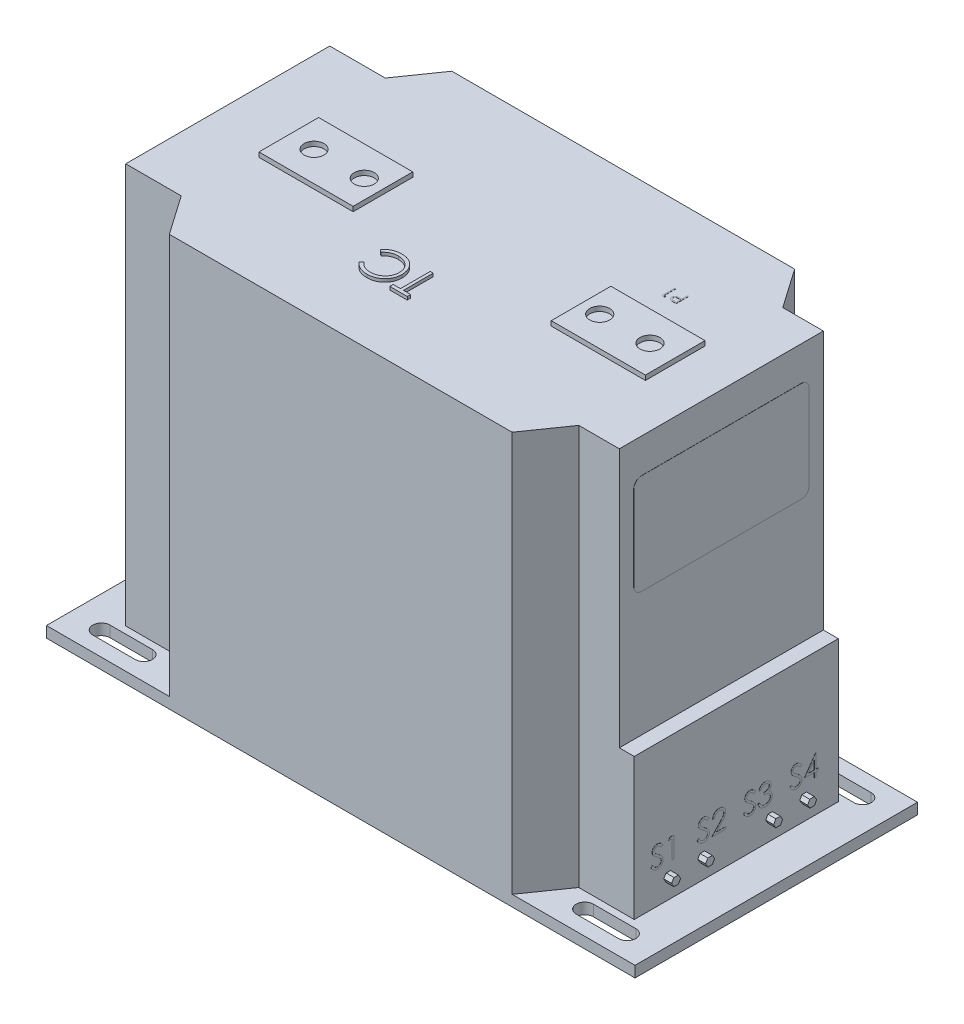
from build123d import *

# Parameters (mm, degrees)
CROQUIS1_W              = 375
CROQUIS1_H              = 180
SALIENTE_EXTRUIR1_DEPTH = 262
CROQUIS2_W              = 60
CROQUIS2_H              = 38
CROQUIS2_R              = 6.35
SALIENTE_EXTRUIR2_DEPTH = 3
CORTAR_EXTRUIR1_DEPTH   = 255
CORTAR_EXTRUIR2_DEPTH   = 277
CROQUIS5_W              = 130
CROQUIS5_H              = 165
CORTAR_EXTRUIR3_DEPTH   = 9.5
SALIENTE_EXTRUIR3_DEPTH = 5
SALIENTE_EXTRUIR4_DEPTH = 0.1
SALIENTE_EXTRUIR5_DEPTH = 0.1
CROQUIS9_R              = 4.75
SALIENTE_EXTRUIR6_DEPTH = 5
SALIENTE_EXTRUIR7_DEPTH = 0.1
SALIENTE_EXTRUIR8_DEPTH = 2


with BuildPart() as part:
    # Croquis1 → Saliente-Extruir1 (new body)
    with BuildSketch(Plane(origin=(0, 0, 0), x_dir=(1, 0, 0), z_dir=(0, 1, 0))):
        Rectangle(CROQUIS1_W, CROQUIS1_H)
    extrude(amount=SALIENTE_EXTRUIR1_DEPTH)

    # Croquis2 → Saliente-Extruir2 (add)
    # profile 1 of 2: a face of its own
    with BuildSketch(Plane(origin=(0, 262, 0), x_dir=(1, 0, 0), z_dir=(0, 1, 0))):
        with Locations((93.107795334, 0)):
            Rectangle(CROQUIS2_W, CROQUIS2_H)
        with Locations(Location((75, 0, 0), (0, 0, 270))):
            Circle(CROQUIS2_R, mode=Mode.SUBTRACT)
        with Locations(Location((107, 0, 0), (0, 0, 270))):
            Circle(CROQUIS2_R, mode=Mode.SUBTRACT)
    # profile 2 of 2: a face of its own
    with BuildSketch(Plane(origin=(0, 262, 0), x_dir=(1, 0, 0), z_dir=(0, 1, 0))):
        with Locations((-93.107795334, 0)):
            Rectangle(CROQUIS2_W, CROQUIS2_H)
        with Locations(Location((-107, 0, 0), (0, 0, 90))):
            Circle(CROQUIS2_R, mode=Mode.SUBTRACT)
        with Locations(Location((-75, 0, 0), (0, 0, 90))):
            Circle(CROQUIS2_R, mode=Mode.SUBTRACT)
    extrude(amount=SALIENTE_EXTRUIR2_DEPTH)

    # Croquis3 → Cortar-Extruir1 (cut)
    # profile 1 of 2: a face of its own
    with BuildSketch(Plane(origin=(0, 262, 0), x_dir=(1, 0, 0), z_dir=(0, 1, 0))):
        Polygon((-162, 65), (-126.646674595, 65), (-109.194539491, 90), (-187.5, 90), (-187.5, -90), (-109.194539491, -90), (-126.646674595, -65), (-162, -65), align=None)
        with BuildLine():
            ThreePointArc((-167.5, -80.5), (-173, -75), (-167.5, -69.5))
            Line((-167.5, -69.5), (-140.5, -69.5))
            ThreePointArc((-140.5, -69.5), (-135, -75), (-140.5, -80.5))
            Line((-140.5, -80.5), (-167.5, -80.5))
        make_face(mode=Mode.SUBTRACT)
        with BuildLine():
            Line((-140.5, 69.5), (-167.5, 69.5))
            ThreePointArc((-167.5, 69.5), (-173, 75), (-167.5, 80.5))
            Line((-167.5, 80.5), (-140.5, 80.5))
            ThreePointArc((-140.5, 80.5), (-135, 75), (-140.5, 69.5))
        make_face(mode=Mode.SUBTRACT)
    # profile 2 of 2: a face of its own
    with BuildSketch(Plane(origin=(0, 262, 0), x_dir=(1, 0, 0), z_dir=(0, 1, 0))):
        Polygon((187.5, 90), (109.194539491, 90), (126.646674595, 65), (162, 65), (162, -65), (126.646674595, -65), (109.194539491, -90), (187.5, -90), align=None)
        with BuildLine():
            Line((140.5, -69.5), (167.5, -69.5))
            ThreePointArc((167.5, -69.5), (173, -75), (167.5, -80.5))
            Line((167.5, -80.5), (140.5, -80.5))
            ThreePointArc((140.5, -80.5), (135, -75), (140.5, -69.5))
        make_face(mode=Mode.SUBTRACT)
        with BuildLine():
            ThreePointArc((167.5, 80.5), (173, 75), (167.5, 69.5))
            Line((167.5, 69.5), (140.5, 69.5))
            ThreePointArc((140.5, 69.5), (135, 75), (140.5, 80.5))
            Line((140.5, 80.5), (167.5, 80.5))
        make_face(mode=Mode.SUBTRACT)
    extrude(amount=-CORTAR_EXTRUIR1_DEPTH, mode=Mode.SUBTRACT)

    # Croquis4 → Cortar-Extruir2 (cut)
    with BuildSketch(Plane(origin=(0, 262, 0), x_dir=(1, 0, 0), z_dir=(0, 1, 0))):
        with BuildLine():
            Line((-167.5, 80.5), (-140.5, 80.5))
            ThreePointArc((-140.5, 80.5), (-135, 75), (-140.5, 69.5))
            Line((-140.5, 69.5), (-167.5, 69.5))
            ThreePointArc((-167.5, 69.5), (-173, 75), (-167.5, 80.5))
        make_face()
        with BuildLine():
            Line((-167.5, -69.5), (-140.5, -69.5))
            ThreePointArc((-140.5, -69.5), (-135, -75), (-140.5, -80.5))
            Line((-140.5, -80.5), (-167.5, -80.5))
            ThreePointArc((-167.5, -80.5), (-173, -75), (-167.5, -69.5))
        make_face()
        with BuildLine():
            Line((140.5, 80.5), (167.5, 80.5))
            ThreePointArc((167.5, 80.5), (173, 75), (167.5, 69.5))
            Line((167.5, 69.5), (140.5, 69.5))
            ThreePointArc((140.5, 69.5), (135, 75), (140.5, 80.5))
        make_face()
        with BuildLine():
            Line((140.5, -69.5), (167.5, -69.5))
            ThreePointArc((167.5, -69.5), (173, -75), (167.5, -80.5))
            Line((167.5, -80.5), (140.5, -80.5))
            ThreePointArc((140.5, -80.5), (135, -75), (140.5, -69.5))
        make_face()
    extrude(amount=-CORTAR_EXTRUIR2_DEPTH, mode=Mode.SUBTRACT)

    # Croquis5 → Cortar-Extruir3 (cut)
    with BuildSketch(Plane(origin=(162, 0, 0), x_dir=(0, 0, -1), z_dir=(1, 0, 0))):
        with Locations((0, 179.5)):
            Rectangle(CROQUIS5_W, CROQUIS5_H)
    extrude(amount=-CORTAR_EXTRUIR3_DEPTH, mode=Mode.SUBTRACT)

    # Croquis6 → Saliente-Extruir3 (add)
    with BuildSketch(Plane(origin=(162, 0, 0), x_dir=(0, 0, -1), z_dir=(1, 0, 0))):
        Polygon((24.553418013, 20), (23.11004234, 22.5), (20.223290994, 22.5), (18.779915321, 20), (20.223290994, 17.5), (23.11004234, 17.5), align=None)
        Polygon((44.857060225, 17.546077271), (46.222022868, 20.089738081), (44.701629309, 22.54366081), (41.816273108, 22.453922729), (40.451310465, 19.910261919), (41.971704024, 17.45633919), align=None)
        Polygon((-41.971704024, 17.45633919), (-44.857060225, 17.546077271), (-46.222022868, 20.089738081), (-44.701629309, 22.54366081), (-41.816273108, 22.453922729), (-40.451310465, 19.910261919), align=None)
        Polygon((-23.11004234, 17.5), (-24.553418013, 20), (-23.11004234, 22.5), (-20.223290994, 22.5), (-18.779915321, 20), (-20.223290994, 17.5), align=None)
    extrude(amount=SALIENTE_EXTRUIR3_DEPTH)

    # Croquis7 → Saliente-Extruir4 (add)
    # profile 1 of 8: a face of its own
    with BuildSketch(Plane(origin=(162, 0, 0), x_dir=(0, 0, -1), z_dir=(1, 0, 0))):
        with BuildLine():
            Line((-54.484508547, 30.4061874), (-53.366177551, 31.076655983))
            add(Edge.make_bspline(
                [(-53.366177551, 31.076655983), (-53.262165166, 30.902543576), (-53.06288145, 30.568950922), (-52.730446254, 30.118183924), (-52.385985548, 29.735059105), (-52.026948483, 29.421805261), (-51.655526596, 29.175180005), (-51.269295203, 29.00054657), (-50.869555859, 28.891629044), (-50.59751195, 28.87839955), (-50.461697049, 28.871794872)],
                knots=[0, 0, 0, 0, 1.272034388, 2.437168799, 3.508375237, 4.49857839, 5.41946034, 6.295179144, 7.148887113, 8, 8, 8, 8], degree=3))
            add(Edge.make_bspline(
                [(-50.461697049, 28.871794872), (-50.345708022, 28.87502533), (-50.115759505, 28.881429722), (-49.777235551, 28.942967278), (-49.448465048, 29.03750717), (-49.136224067, 29.172901762), (-48.844821, 29.336710919), (-48.589283788, 29.534567007), (-48.368371396, 29.756084511), (-48.187664326, 30.003215378), (-48.049022526, 30.268997457), (-47.94246322, 30.541805369), (-47.883328566, 30.825924659), (-47.8744206, 31.017220159), (-47.869925214, 31.113757011)],
                knots=[0, 0, 0, 0, 1.095163259, 2.171163733, 3.241058638, 4.321873601, 5.38011039, 6.391990106, 7.366004449, 8.327778327, 9.272591725, 10.192022065, 11.087607919, 12, 12, 12, 12], degree=3))
            add(Edge.make_bspline(
                [(-47.869925214, 31.113757011), (-47.875497757, 31.223902485), (-47.886825924, 31.447812137), (-47.982572887, 31.778162016), (-48.133193552, 32.105083337), (-48.272147592, 32.307305383), (-48.344288361, 32.412293002)],
                knots=[0, 0, 0, 0, 0.938893495, 1.908633276, 2.914225137, 4, 4, 4, 4], degree=3))
            add(Edge.make_bspline(
                [(-48.344288361, 32.412293002), (-48.403519552, 32.488065222), (-48.527868027, 32.64713952), (-48.741641959, 32.883923595), (-48.992490069, 33.128165833), (-49.271827911, 33.389192626), (-49.589830955, 33.654863762), (-49.93653912, 33.937848027), (-50.320804301, 34.22738375), (-50.590299422, 34.421559816), (-50.729354467, 34.521751469)],
                knots=[0, 0, 0, 0, 0.722233717, 1.516239348, 2.393582979, 3.351407094, 4.387010283, 5.505090956, 6.712668013, 8, 8, 8, 8], degree=3))
            add(Edge.make_bspline(
                [(-50.729354467, 34.521751469), (-50.868540405, 34.620889285), (-51.13465332, 34.810433241), (-51.506803318, 35.091739314), (-51.839590426, 35.34892894), (-52.131535518, 35.584423272), (-52.382510184, 35.798254248), (-52.594492125, 35.988368482), (-52.762081314, 36.159907537), (-52.855273538, 36.271188799), (-52.89711455, 36.321151342)],
                knots=[0, 0, 0, 0, 1.452282411, 2.77665338, 3.964542531, 5.026858415, 5.96415736, 6.766646006, 7.446254459, 8, 8, 8, 8], degree=3))
            add(Edge.make_bspline(
                [(-52.89711455, 36.321151342), (-52.955597087, 36.399018356), (-53.070610845, 36.55215429), (-53.222428782, 36.791507175), (-53.351466689, 37.036523684), (-53.452621933, 37.28786222), (-53.537803474, 37.541994243), (-53.595096843, 37.802235559), (-53.630972064, 38.067418432), (-53.634645941, 38.245874223), (-53.636485043, 38.335207165)],
                knots=[0, 0, 0, 0, 1.068054152, 2.10047183, 3.106115577, 4.101338837, 5.06977816, 6.043150881, 7.020423561, 8, 8, 8, 8], degree=3))
            add(Edge.make_bspline(
                [(-53.636485043, 38.335207165), (-53.631551664, 38.475170896), (-53.621790353, 38.752106732), (-53.539238397, 39.156657788), (-53.408939067, 39.542898115), (-53.22639589, 39.90700384), (-52.991077919, 40.239494304), (-52.71876129, 40.544194091), (-52.394414303, 40.800343196), (-52.038539804, 41.024150679), (-51.649011255, 41.199327242), (-51.240831352, 41.331471422), (-50.813351348, 41.4063457), (-50.523809738, 41.417090675), (-50.376894698, 41.422542735)],
                knots=[0, 0, 0, 0, 1.005424448, 1.989358655, 2.955360095, 3.929531133, 4.905563448, 5.876582895, 6.856512386, 7.866279853, 8.892233794, 9.918561126, 10.94386622, 12, 12, 12, 12], degree=3))
            add(Edge.make_bspline(
                [(-50.376894698, 41.422542735), (-50.221001819, 41.417165829), (-49.910980638, 41.406472878), (-49.45495533, 41.313500066), (-49.015895479, 41.159661218), (-48.662702186, 40.985079088), (-48.38627776, 40.81071332), (-48.17547011, 40.651888389), (-47.961847603, 40.469041996), (-47.743687098, 40.261687108), (-47.524685201, 40.027921114), (-47.301590604, 39.769344998), (-47.073881612, 39.487538969), (-46.927393688, 39.286363028), (-46.852297009, 39.183230669)],
                knots=[0, 0, 0, 0, 1.286793592, 2.559021753, 3.825965368, 5.121522368, 5.803751409, 6.523245864, 7.299691795, 8.125521123, 9.008227632, 9.944561021, 10.946284179, 12, 12, 12, 12], degree=3))
            Line((-46.852297009, 39.183230669), (-47.925576756, 38.36965812))
            add(Edge.make_bspline(
                [(-47.925576756, 38.36965812), (-47.990384299, 38.45314811), (-48.115188473, 38.613930311), (-48.304665997, 38.839095701), (-48.483254637, 39.044777037), (-48.659204065, 39.223427967), (-48.82322166, 39.384831864), (-48.982414051, 39.52301904), (-49.13449032, 39.639343464), (-49.326188166, 39.7634843), (-49.567025971, 39.886540132), (-49.869348474, 39.990669088), (-50.185284692, 40.05324328), (-50.400465144, 40.061516754), (-50.509398371, 40.065705128)],
                knots=[0, 0, 0, 0, 1.181633172, 2.275549214, 3.290209073, 4.226197932, 5.078386478, 5.862611352, 6.581680152, 7.217281963, 8.414376989, 9.595101626, 10.782541182, 12, 12, 12, 12], degree=3))
            add(Edge.make_bspline(
                [(-50.509398371, 40.065705128), (-50.646061417, 40.061125191), (-50.909603227, 40.052293213), (-51.28376275, 39.955833745), (-51.620516574, 39.80395588), (-51.909867043, 39.591098671), (-52.150777641, 39.338909205), (-52.325045298, 39.048703413), (-52.429934313, 38.728246118), (-52.442733643, 38.504704738), (-52.449252137, 38.390858707)],
                knots=[0, 0, 0, 0, 1.14458467, 2.207223713, 3.21896685, 4.227309161, 5.202851033, 6.127160689, 7.046193047, 8, 8, 8, 8], degree=3))
            add(Edge.make_bspline(
                [(-52.449252137, 38.390858707), (-52.447766212, 38.319982583), (-52.444791932, 38.178114438), (-52.40330981, 37.968521266), (-52.350017703, 37.759457572), (-52.265567875, 37.551863286), (-52.148979971, 37.342107822), (-51.99588005, 37.12657923), (-51.803061877, 36.903377831), (-51.655360074, 36.758207103), (-51.577377971, 36.681561331)],
                knots=[0, 0, 0, 0, 0.858281714, 1.717966888, 2.583508476, 3.4729293, 4.427298488, 5.488583878, 6.674047936, 8, 8, 8, 8], degree=3))
            add(Edge.make_bspline(
                [(-51.577377971, 36.681561331), (-51.548419808, 36.655719002), (-51.47962184, 36.594323542), (-51.353846763, 36.493811052), (-51.187753449, 36.369824383), (-50.985679057, 36.216413991), (-50.74389766, 36.038457274), (-50.462382671, 35.838229632), (-50.144272116, 35.609231023), (-49.918537493, 35.449129604), (-49.799178686, 35.364474826)],
                knots=[0, 0, 0, 0, 0.420754252, 0.999615792, 1.744751191, 2.668019286, 3.750313428, 4.999500688, 6.413464383, 8, 8, 8, 8], degree=3))
            add(Edge.make_bspline(
                [(-49.799178686, 35.364474826), (-49.655600978, 35.259997069), (-49.377582646, 35.057690371), (-48.982001912, 34.753738247), (-48.623325911, 34.456468407), (-48.30029535, 34.167779238), (-48.00971894, 33.889860553), (-47.754820413, 33.61936877), (-47.533002514, 33.358241754), (-47.294200111, 33.023458507), (-47.050186924, 32.612291909), (-46.840631226, 32.1085319), (-46.708496996, 31.602813665), (-46.691217756, 31.262911634), (-46.682692308, 31.095206497)],
                knots=[0, 0, 0, 0, 1.163667725, 2.253281268, 3.268753668, 4.215851969, 5.092017293, 5.902905408, 6.650798638, 7.335211899, 8.59617414, 9.77448103, 10.901945474, 12, 12, 12, 12], degree=3))
            add(Edge.make_bspline(
                [(-46.682692308, 31.095206497), (-46.685176133, 30.976603748), (-46.69009555, 30.741701435), (-46.746644242, 30.396778972), (-46.829495358, 30.061775387), (-46.954368236, 29.740831599), (-47.106780174, 29.428076097), (-47.300176408, 29.131712902), (-47.524345335, 28.845182765), (-47.781496768, 28.576126116), (-48.062884554, 28.329133054), (-48.360290185, 28.109419042), (-48.674200443, 27.926220319), (-49.002912414, 27.776727553), (-49.346501603, 27.659806222), (-49.704852453, 27.575090913), (-50.078555665, 27.523097601), (-50.332557485, 27.517701003), (-50.461697049, 27.514957265)],
                knots=[0, 0, 0, 0, 0.983748083, 1.948392443, 2.894712957, 3.844097841, 4.80183111, 5.778335162, 6.776009319, 7.81870978, 8.863265674, 9.881300176, 10.883814829, 11.87499822, 12.874611388, 13.892143829, 14.928324115, 16, 16, 16, 16], degree=3))
            add(Edge.make_bspline(
                [(-50.461697049, 27.514957265), (-50.561616351, 27.51688941), (-50.760196575, 27.520729366), (-51.053919914, 27.554676467), (-51.341709433, 27.602706293), (-51.619953892, 27.678959475), (-51.892238156, 27.77147662), (-52.157378001, 27.885392341), (-52.415501925, 28.021906764), (-52.668056479, 28.177992124), (-52.914399341, 28.359638957), (-53.152219949, 28.571205446), (-53.389321335, 28.806856611), (-53.618705244, 29.072991776), (-53.845011474, 29.365311315), (-54.063778081, 29.686550193), (-54.279533383, 30.034958643), (-54.414907324, 30.280133223), (-54.484508547, 30.4061874)],
                knots=[0, 0, 0, 0, 0.915332311, 1.819136955, 2.706846663, 3.586547465, 4.459518054, 5.340707479, 6.227863349, 7.133153174, 8.059268498, 9.028702269, 10.047606654, 11.120612155, 12.245963614, 13.433783089, 14.680604001, 16, 16, 16, 16], degree=3))
        make_face()
    # profile 2 of 8: a face of its own
    with BuildSketch(Plane(origin=(162, 0, 0), x_dir=(0, 0, -1), z_dir=(1, 0, 0))):
        Polygon((-42.344522069, 41.083333333), (-39.898504274, 41.083333333), (-39.898504274, 27.854166667), (-41.085737179, 27.854166667), (-41.085737179, 39.726495726), (-43.12099359, 39.726495726), align=None)
    # profile 3 of 8: a face of its own
    with BuildSketch(Plane(origin=(162, 0, 0), x_dir=(0, 0, -1), z_dir=(1, 0, 0))):
        with BuildLine():
            Line((-24.973290598, 30.4061874), (-23.854959602, 31.076655983))
            add(Edge.make_bspline(
                [(-23.854959602, 31.076655983), (-23.750947217, 30.902543576), (-23.551663502, 30.568950922), (-23.219228305, 30.118183924), (-22.874767599, 29.735059105), (-22.515730535, 29.421805261), (-22.144308647, 29.175180005), (-21.758077254, 29.00054657), (-21.35833791, 28.891629044), (-21.086294001, 28.87839955), (-20.9504791, 28.871794872)],
                knots=[0, 0, 0, 0, 1.272034388, 2.437168799, 3.508375237, 4.49857839, 5.41946034, 6.295179144, 7.148887113, 8, 8, 8, 8], degree=3))
            add(Edge.make_bspline(
                [(-20.9504791, 28.871794872), (-20.834490074, 28.87502533), (-20.604541556, 28.881429722), (-20.266017602, 28.942967278), (-19.9372471, 29.03750717), (-19.625006118, 29.172901762), (-19.333603051, 29.336710919), (-19.078065839, 29.534567007), (-18.857153447, 29.756084511), (-18.676446377, 30.003215378), (-18.537804577, 30.268997457), (-18.431245271, 30.541805369), (-18.372110618, 30.825924659), (-18.363202651, 31.017220159), (-18.358707265, 31.113757011)],
                knots=[0, 0, 0, 0, 1.095163259, 2.171163733, 3.241058638, 4.321873601, 5.38011039, 6.391990106, 7.366004449, 8.327778327, 9.272591725, 10.192022065, 11.087607919, 12, 12, 12, 12], degree=3))
            add(Edge.make_bspline(
                [(-18.358707265, 31.113757011), (-18.364279808, 31.223902485), (-18.375607975, 31.447812137), (-18.471354938, 31.778162016), (-18.621975603, 32.105083337), (-18.760929644, 32.307305383), (-18.833070413, 32.412293002)],
                knots=[0, 0, 0, 0, 0.938893495, 1.908633276, 2.914225137, 4, 4, 4, 4], degree=3))
            add(Edge.make_bspline(
                [(-18.833070413, 32.412293002), (-18.892301603, 32.488065222), (-19.016650079, 32.64713952), (-19.23042401, 32.883923595), (-19.481272121, 33.128165833), (-19.760609962, 33.389192626), (-20.078613006, 33.654863762), (-20.425321171, 33.937848027), (-20.809586352, 34.22738375), (-21.079081473, 34.421559816), (-21.218136518, 34.521751469)],
                knots=[0, 0, 0, 0, 0.722233717, 1.516239348, 2.393582979, 3.351407094, 4.387010283, 5.505090956, 6.712668013, 8, 8, 8, 8], degree=3))
            add(Edge.make_bspline(
                [(-21.218136518, 34.521751469), (-21.357322456, 34.620889285), (-21.623435371, 34.810433241), (-21.99558537, 35.091739314), (-22.328372477, 35.34892894), (-22.620317569, 35.584423272), (-22.871292236, 35.798254248), (-23.083274176, 35.988368482), (-23.250863365, 36.159907537), (-23.34405559, 36.271188799), (-23.385896601, 36.321151342)],
                knots=[0, 0, 0, 0, 1.452282411, 2.77665338, 3.964542531, 5.026858415, 5.96415736, 6.766646006, 7.446254459, 8, 8, 8, 8], degree=3))
            add(Edge.make_bspline(
                [(-23.385896601, 36.321151342), (-23.444379138, 36.399018356), (-23.559392896, 36.55215429), (-23.711210833, 36.791507175), (-23.84024874, 37.036523684), (-23.941403984, 37.28786222), (-24.026585525, 37.541994243), (-24.083878894, 37.802235559), (-24.119754115, 38.067418432), (-24.123427993, 38.245874223), (-24.125267094, 38.335207165)],
                knots=[0, 0, 0, 0, 1.068054152, 2.10047183, 3.106115577, 4.101338837, 5.06977816, 6.043150881, 7.020423561, 8, 8, 8, 8], degree=3))
            add(Edge.make_bspline(
                [(-24.125267094, 38.335207165), (-24.120333715, 38.475170896), (-24.110572404, 38.752106732), (-24.028020449, 39.156657788), (-23.897721118, 39.542898115), (-23.715177941, 39.90700384), (-23.47985997, 40.239494304), (-23.207543341, 40.544194091), (-22.883196354, 40.800343196), (-22.527321856, 41.024150679), (-22.137793306, 41.199327242), (-21.729613404, 41.331471422), (-21.302133399, 41.4063457), (-21.012591789, 41.417090675), (-20.865676749, 41.422542735)],
                knots=[0, 0, 0, 0, 1.005424448, 1.989358655, 2.955360095, 3.929531133, 4.905563448, 5.876582895, 6.856512386, 7.866279853, 8.892233794, 9.918561126, 10.94386622, 12, 12, 12, 12], degree=3))
            add(Edge.make_bspline(
                [(-20.865676749, 41.422542735), (-20.70978387, 41.417165829), (-20.39976269, 41.406472878), (-19.943737381, 41.313500066), (-19.50467753, 41.159661218), (-19.151484238, 40.985079088), (-18.875059812, 40.81071332), (-18.664252161, 40.651888389), (-18.450629654, 40.469041996), (-18.232469149, 40.261687108), (-18.013467252, 40.027921114), (-17.790372656, 39.769344998), (-17.562663663, 39.487538969), (-17.41617574, 39.286363028), (-17.34107906, 39.183230669)],
                knots=[0, 0, 0, 0, 1.286793592, 2.559021753, 3.825965368, 5.121522368, 5.803751409, 6.523245864, 7.299691795, 8.125521123, 9.008227632, 9.944561021, 10.946284179, 12, 12, 12, 12], degree=3))
            Line((-17.34107906, 39.183230669), (-18.414358807, 38.36965812))
            add(Edge.make_bspline(
                [(-18.414358807, 38.36965812), (-18.47916635, 38.45314811), (-18.603970524, 38.613930311), (-18.793448049, 38.839095701), (-18.972036688, 39.044777037), (-19.147986116, 39.223427967), (-19.312003711, 39.384831864), (-19.471196103, 39.52301904), (-19.623272371, 39.639343464), (-19.814970218, 39.7634843), (-20.055808022, 39.886540132), (-20.358130525, 39.990669088), (-20.674066743, 40.05324328), (-20.889247196, 40.061516754), (-20.998180422, 40.065705128)],
                knots=[0, 0, 0, 0, 1.181633172, 2.275549214, 3.290209073, 4.226197932, 5.078386478, 5.862611352, 6.581680152, 7.217281963, 8.414376989, 9.595101626, 10.782541182, 12, 12, 12, 12], degree=3))
            add(Edge.make_bspline(
                [(-20.998180422, 40.065705128), (-21.134843468, 40.061125191), (-21.398385278, 40.052293213), (-21.772544802, 39.955833745), (-22.109298625, 39.80395588), (-22.398649095, 39.591098671), (-22.639559692, 39.338909205), (-22.813827349, 39.048703413), (-22.918716364, 38.728246118), (-22.931515695, 38.504704738), (-22.938034188, 38.390858707)],
                knots=[0, 0, 0, 0, 1.14458467, 2.207223713, 3.21896685, 4.227309161, 5.202851033, 6.127160689, 7.046193047, 8, 8, 8, 8], degree=3))
            add(Edge.make_bspline(
                [(-22.938034188, 38.390858707), (-22.936548263, 38.319982583), (-22.933573983, 38.178114438), (-22.892091861, 37.968521266), (-22.838799754, 37.759457572), (-22.754349926, 37.551863286), (-22.637762022, 37.342107822), (-22.484662102, 37.12657923), (-22.291843928, 36.903377831), (-22.144142125, 36.758207103), (-22.066160023, 36.681561331)],
                knots=[0, 0, 0, 0, 0.858281714, 1.717966888, 2.583508476, 3.4729293, 4.427298488, 5.488583878, 6.674047936, 8, 8, 8, 8], degree=3))
            add(Edge.make_bspline(
                [(-22.066160023, 36.681561331), (-22.037201859, 36.655719002), (-21.968403891, 36.594323542), (-21.842628815, 36.493811052), (-21.6765355, 36.369824383), (-21.474461109, 36.216413991), (-21.232679712, 36.038457274), (-20.951164723, 35.838229632), (-20.633054167, 35.609231023), (-20.407319544, 35.449129604), (-20.287960737, 35.364474826)],
                knots=[0, 0, 0, 0, 0.420754252, 0.999615792, 1.744751191, 2.668019286, 3.750313428, 4.999500688, 6.413464383, 8, 8, 8, 8], degree=3))
            add(Edge.make_bspline(
                [(-20.287960737, 35.364474826), (-20.144383029, 35.259997069), (-19.866364697, 35.057690371), (-19.470783963, 34.753738247), (-19.112107963, 34.456468407), (-18.789077401, 34.167779238), (-18.498500992, 33.889860553), (-18.243602464, 33.61936877), (-18.021784565, 33.358241754), (-17.782982162, 33.023458507), (-17.538968975, 32.612291909), (-17.329413277, 32.1085319), (-17.197279047, 31.602813665), (-17.179999808, 31.262911634), (-17.171474359, 31.095206497)],
                knots=[0, 0, 0, 0, 1.163667725, 2.253281268, 3.268753668, 4.215851969, 5.092017293, 5.902905408, 6.650798638, 7.335211899, 8.59617414, 9.77448103, 10.901945474, 12, 12, 12, 12], degree=3))
            add(Edge.make_bspline(
                [(-17.171474359, 31.095206497), (-17.173958185, 30.976603748), (-17.178877602, 30.741701435), (-17.235426294, 30.396778972), (-17.318277409, 30.061775387), (-17.443150287, 29.740831599), (-17.595562225, 29.428076097), (-17.788958459, 29.131712902), (-18.013127387, 28.845182765), (-18.27027882, 28.576126116), (-18.551666605, 28.329133054), (-18.849072237, 28.109419042), (-19.162982495, 27.926220319), (-19.491694465, 27.776727553), (-19.835283655, 27.659806222), (-20.193634504, 27.575090913), (-20.567337716, 27.523097601), (-20.821339537, 27.517701003), (-20.9504791, 27.514957265)],
                knots=[0, 0, 0, 0, 0.983748083, 1.948392443, 2.894712957, 3.844097841, 4.80183111, 5.778335162, 6.776009319, 7.81870978, 8.863265674, 9.881300176, 10.883814829, 11.87499822, 12.874611388, 13.892143829, 14.928324115, 16, 16, 16, 16], degree=3))
            add(Edge.make_bspline(
                [(-20.9504791, 27.514957265), (-21.050398402, 27.51688941), (-21.248978626, 27.520729366), (-21.542701965, 27.554676467), (-21.830491484, 27.602706293), (-22.108735943, 27.678959475), (-22.381020207, 27.77147662), (-22.646160052, 27.885392341), (-22.904283976, 28.021906764), (-23.15683853, 28.177992124), (-23.403181392, 28.359638957), (-23.641002, 28.571205446), (-23.878103386, 28.806856611), (-24.107487295, 29.072991776), (-24.333793525, 29.365311315), (-24.552560132, 29.686550193), (-24.768315434, 30.034958643), (-24.903689375, 30.280133223), (-24.973290598, 30.4061874)],
                knots=[0, 0, 0, 0, 0.915332311, 1.819136955, 2.706846663, 3.586547465, 4.459518054, 5.340707479, 6.227863349, 7.133153174, 8.059268498, 9.028702269, 10.047606654, 11.120612155, 12.245963614, 13.433783089, 14.680604001, 16, 16, 16, 16], degree=3))
        make_face()
    # profile 4 of 8: a face of its own
    with BuildSketch(Plane(origin=(162, 0, 0), x_dir=(0, 0, -1), z_dir=(1, 0, 0))):
        with BuildLine():
            Line((-13.948985043, 37.012820513), (-15.136217949, 37.012820513))
            add(Edge.make_bspline(
                [(-15.136217949, 37.012820513), (-15.128480198, 37.170326547), (-15.113283461, 37.479664206), (-15.04211701, 37.930680162), (-14.940286909, 38.361780145), (-14.796310282, 38.769502737), (-14.617503816, 39.15745299), (-14.403077819, 39.524089954), (-14.149101063, 39.868014983), (-13.861057753, 40.186039778), (-13.548212004, 40.477790417), (-13.210656816, 40.729731365), (-12.855944957, 40.942598754), (-12.485152586, 41.120554638), (-12.094096289, 41.254130841), (-11.686324773, 41.353242396), (-11.260046489, 41.412873226), (-10.969609501, 41.419282892), (-10.821898371, 41.422542735)],
                knots=[0, 0, 0, 0, 1.10065271, 2.161652631, 3.183658789, 4.190468796, 5.17591951, 6.163126047, 7.15150782, 8.156236427, 9.156009102, 10.134482811, 11.092018607, 12.041330605, 13.001268258, 13.972401359, 14.968799086, 16, 16, 16, 16], degree=3))
            add(Edge.make_bspline(
                [(-10.821898371, 41.422542735), (-10.676838388, 41.419146784), (-10.391800705, 41.41247386), (-9.975792495, 41.355168779), (-9.579759269, 41.265416097), (-9.204475152, 41.139491755), (-8.852934372, 40.970217283), (-8.522496078, 40.766875396), (-8.209226347, 40.531699247), (-7.927230469, 40.254817274), (-7.668286241, 39.95923088), (-7.444893788, 39.643666483), (-7.253588081, 39.317740313), (-7.094128696, 38.978967051), (-6.976743885, 38.624156914), (-6.887623872, 38.258475523), (-6.837249422, 37.878137695), (-6.829518208, 37.620711131), (-6.825587607, 37.489833734)],
                knots=[0, 0, 0, 0, 1.111607364, 2.184268762, 3.212621178, 4.221274766, 5.211760367, 6.196651075, 7.1921475, 8.207485113, 9.220403448, 10.201281604, 11.166441695, 12.114753415, 13.065576456, 14.026450734, 14.996634279, 16, 16, 16, 16], degree=3))
            add(Edge.make_bspline(
                [(-6.825587607, 37.489833734), (-6.831987737, 37.305578526), (-6.844675685, 36.940301528), (-6.953209192, 36.40351916), (-7.122718326, 35.883448796), (-7.326815478, 35.46488816), (-7.532708347, 35.1276068), (-7.718247438, 34.849912588), (-7.935450742, 34.550912752), (-8.187479588, 34.23160853), (-8.469120504, 33.889498859), (-8.782924514, 33.524790406), (-9.131129342, 33.141251276), (-9.37552308, 32.879292604), (-9.502161792, 32.743552183)],
                knots=[0, 0, 0, 0, 1.184426356, 2.348067706, 3.509069118, 4.696110526, 5.333549288, 6.050745305, 6.844228056, 7.710549037, 8.667450064, 9.695053472, 10.805634456, 12, 12, 12, 12], degree=3))
            Line((-9.502161792, 32.743552183), (-12.812103532, 29.211004274))
            Line((-12.812103532, 29.211004274), (-6.655982906, 29.211004274))
            Line((-6.655982906, 29.211004274), (-6.655982906, 27.854166667))
            Line((-6.655982906, 27.854166667), (-15.645032051, 27.854166667))
            Line((-15.645032051, 27.854166667), (-10.51448985, 33.329218416))
            add(Edge.make_bspline(
                [(-10.51448985, 33.329218416), (-10.389576707, 33.459613801), (-10.149644122, 33.710076649), (-9.810287359, 34.075742004), (-9.505491183, 34.4149739), (-9.233282585, 34.727131389), (-8.999566657, 35.01678047), (-8.792162685, 35.274540213), (-8.625983219, 35.511737093), (-8.445630384, 35.786679295), (-8.270952538, 36.122368708), (-8.120849287, 36.532600212), (-8.029322926, 36.954902625), (-8.018343339, 37.240282349), (-8.012820513, 37.383830796)],
                knots=[0, 0, 0, 0, 1.329631726, 2.553950428, 3.673215718, 4.687767853, 5.603093632, 6.413772471, 7.123043292, 7.734684054, 8.834405432, 9.900288307, 10.943827018, 12, 12, 12, 12], degree=3))
            add(Edge.make_bspline(
                [(-8.012820513, 37.383830796), (-8.015223467, 37.474096796), (-8.019959229, 37.651993748), (-8.061754693, 37.912819087), (-8.124916427, 38.164418235), (-8.215423802, 38.407565099), (-8.334889754, 38.639815034), (-8.480309969, 38.861450747), (-8.64809384, 39.075721539), (-8.842189412, 39.27662835), (-9.055411525, 39.460631716), (-9.2806636, 39.623630491), (-9.518977982, 39.759849749), (-9.769349872, 39.871517134), (-10.031081259, 39.959114557), (-10.304678362, 40.019812164), (-10.589385209, 40.057921553), (-10.783791576, 40.063077798), (-10.88285006, 40.065705128)],
                knots=[0, 0, 0, 0, 0.991446411, 1.95395049, 2.89581595, 3.838931463, 4.798493298, 5.75982156, 6.748411868, 7.785213223, 8.824556874, 9.840280684, 10.836137867, 11.835679398, 12.848801643, 13.863922112, 14.911575587, 16, 16, 16, 16], degree=3))
            add(Edge.make_bspline(
                [(-10.88285006, 40.065705128), (-10.986305291, 40.063002476), (-11.189474283, 40.057694915), (-11.487769437, 40.020567584), (-11.772331751, 39.956516342), (-12.043877039, 39.868914031), (-12.302864759, 39.75756773), (-12.548035402, 39.618881671), (-12.778838584, 39.453390492), (-12.995708181, 39.265761008), (-13.195521436, 39.056862635), (-13.371079568, 38.823991643), (-13.524477478, 38.571399924), (-13.65831595, 38.299769034), (-13.767005612, 38.006634211), (-13.850058889, 37.693036041), (-13.91577703, 37.360336176), (-13.937731855, 37.130583028), (-13.948985043, 37.012820513)],
                knots=[0, 0, 0, 0, 1.031018746, 2.02475058, 2.990194455, 3.934040569, 4.864654155, 5.795059489, 6.735614925, 7.690564532, 8.649604399, 9.611025574, 10.590972636, 11.591080095, 12.624614302, 13.701020113, 14.821632451, 16, 16, 16, 16], degree=3))
        make_face()
    # profile 5 of 8: a face of its own
    with BuildSketch(Plane(origin=(162, 0, 0), x_dir=(0, 0, -1), z_dir=(1, 0, 0))):
        with BuildLine():
            Line((4.53792735, 30.4061874), (5.656258347, 31.076655983))
            add(Edge.make_bspline(
                [(5.656258347, 31.076655983), (5.760270732, 30.902543576), (5.959554447, 30.568950922), (6.291989644, 30.118183924), (6.63645035, 29.735059105), (6.995487414, 29.421805261), (7.366909301, 29.175180005), (7.753140695, 29.00054657), (8.152880039, 28.891629044), (8.424923947, 28.87839955), (8.560738849, 28.871794872)],
                knots=[0, 0, 0, 0, 1.272034388, 2.437168799, 3.508375237, 4.49857839, 5.41946034, 6.295179144, 7.148887113, 8, 8, 8, 8], degree=3))
            add(Edge.make_bspline(
                [(8.560738849, 28.871794872), (8.676727875, 28.87502533), (8.906676392, 28.881429722), (9.245200346, 28.942967278), (9.573970849, 29.03750717), (9.886211831, 29.172901762), (10.177614898, 29.336710919), (10.433152109, 29.534567007), (10.654064501, 29.756084511), (10.834771571, 30.003215378), (10.973413371, 30.268997457), (11.079972678, 30.541805369), (11.139107331, 30.825924659), (11.148015298, 31.017220159), (11.152510684, 31.113757011)],
                knots=[0, 0, 0, 0, 1.095163259, 2.171163733, 3.241058638, 4.321873601, 5.38011039, 6.391990106, 7.366004449, 8.327778327, 9.272591725, 10.192022065, 11.087607919, 12, 12, 12, 12], degree=3))
            add(Edge.make_bspline(
                [(11.152510684, 31.113757011), (11.14693814, 31.223902485), (11.135609974, 31.447812137), (11.039863011, 31.778162016), (10.889242345, 32.105083337), (10.750288305, 32.307305383), (10.678147536, 32.412293002)],
                knots=[0, 0, 0, 0, 0.938893495, 1.908633276, 2.914225137, 4, 4, 4, 4], degree=3))
            add(Edge.make_bspline(
                [(10.678147536, 32.412293002), (10.618916346, 32.488065222), (10.49456787, 32.64713952), (10.280793939, 32.883923595), (10.029945828, 33.128165833), (9.750607986, 33.389192626), (9.432604942, 33.654863762), (9.085896778, 33.937848027), (8.701631597, 34.22738375), (8.432136475, 34.421559816), (8.29308143, 34.521751469)],
                knots=[0, 0, 0, 0, 0.722233717, 1.516239348, 2.393582979, 3.351407094, 4.387010283, 5.505090956, 6.712668013, 8, 8, 8, 8], degree=3))
            add(Edge.make_bspline(
                [(8.29308143, 34.521751469), (8.153895492, 34.620889285), (7.887782578, 34.810433241), (7.515632579, 35.091739314), (7.182845472, 35.34892894), (6.89090038, 35.584423272), (6.639925713, 35.798254248), (6.427943773, 35.988368482), (6.260354584, 36.159907537), (6.167162359, 36.271188799), (6.125321347, 36.321151342)],
                knots=[0, 0, 0, 0, 1.452282411, 2.77665338, 3.964542531, 5.026858415, 5.96415736, 6.766646006, 7.446254459, 8, 8, 8, 8], degree=3))
            add(Edge.make_bspline(
                [(6.125321347, 36.321151342), (6.06683881, 36.399018356), (5.951825053, 36.55215429), (5.800007115, 36.791507175), (5.670969208, 37.036523684), (5.569813965, 37.28786222), (5.484632423, 37.541994243), (5.427339054, 37.802235559), (5.391463834, 38.067418432), (5.387789956, 38.245874223), (5.385950855, 38.335207165)],
                knots=[0, 0, 0, 0, 1.068054152, 2.10047183, 3.106115577, 4.101338837, 5.06977816, 6.043150881, 7.020423561, 8, 8, 8, 8], degree=3))
            add(Edge.make_bspline(
                [(5.385950855, 38.335207165), (5.390884234, 38.475170896), (5.400645545, 38.752106732), (5.4831975, 39.156657788), (5.61349683, 39.542898115), (5.796040008, 39.90700384), (6.031357978, 40.239494304), (6.303674608, 40.544194091), (6.628021594, 40.800343196), (6.983896093, 41.024150679), (7.373424642, 41.199327242), (7.781604545, 41.331471422), (8.209084549, 41.4063457), (8.498626159, 41.417090675), (8.645541199, 41.422542735)],
                knots=[0, 0, 0, 0, 1.005424448, 1.989358655, 2.955360095, 3.929531133, 4.905563448, 5.876582895, 6.856512386, 7.866279853, 8.892233794, 9.918561126, 10.94386622, 12, 12, 12, 12], degree=3))
            add(Edge.make_bspline(
                [(8.645541199, 41.422542735), (8.801434078, 41.417165829), (9.111455259, 41.406472878), (9.567480568, 41.313500066), (10.006540419, 41.159661218), (10.359733711, 40.985079088), (10.636158137, 40.81071332), (10.846965787, 40.651888389), (11.060588295, 40.469041996), (11.2787488, 40.261687108), (11.497750697, 40.027921114), (11.720845293, 39.769344998), (11.948554285, 39.487538969), (12.095042209, 39.286363028), (12.170138889, 39.183230669)],
                knots=[0, 0, 0, 0, 1.286793592, 2.559021753, 3.825965368, 5.121522368, 5.803751409, 6.523245864, 7.299691795, 8.125521123, 9.008227632, 9.944561021, 10.946284179, 12, 12, 12, 12], degree=3))
            Line((12.170138889, 39.183230669), (11.096859141, 38.36965812))
            add(Edge.make_bspline(
                [(11.096859141, 38.36965812), (11.032051599, 38.45314811), (10.907247425, 38.613930311), (10.7177699, 38.839095701), (10.539181261, 39.044777037), (10.363231833, 39.223427967), (10.199214238, 39.384831864), (10.040021846, 39.52301904), (9.887945578, 39.639343464), (9.696247731, 39.7634843), (9.455409927, 39.886540132), (9.153087424, 39.990669088), (8.837151206, 40.05324328), (8.621970753, 40.061516754), (8.513037527, 40.065705128)],
                knots=[0, 0, 0, 0, 1.181633172, 2.275549214, 3.290209073, 4.226197932, 5.078386478, 5.862611352, 6.581680152, 7.217281963, 8.414376989, 9.595101626, 10.782541182, 12, 12, 12, 12], degree=3))
            add(Edge.make_bspline(
                [(8.513037527, 40.065705128), (8.376374481, 40.061125191), (8.112832671, 40.052293213), (7.738673147, 39.955833745), (7.401919323, 39.80395588), (7.112568854, 39.591098671), (6.871658256, 39.338909205), (6.6973906, 39.048703413), (6.592501585, 38.728246118), (6.579702254, 38.504704738), (6.573183761, 38.390858707)],
                knots=[0, 0, 0, 0, 1.14458467, 2.207223713, 3.21896685, 4.227309161, 5.202851033, 6.127160689, 7.046193047, 8, 8, 8, 8], degree=3))
            add(Edge.make_bspline(
                [(6.573183761, 38.390858707), (6.574669686, 38.319982583), (6.577643966, 38.178114438), (6.619126088, 37.968521266), (6.672418194, 37.759457572), (6.756868023, 37.551863286), (6.873455926, 37.342107822), (7.026555847, 37.12657923), (7.219374021, 36.903377831), (7.367075823, 36.758207103), (7.445057926, 36.681561331)],
                knots=[0, 0, 0, 0, 0.858281714, 1.717966888, 2.583508476, 3.4729293, 4.427298488, 5.488583878, 6.674047936, 8, 8, 8, 8], degree=3))
            add(Edge.make_bspline(
                [(7.445057926, 36.681561331), (7.47401609, 36.655719002), (7.542814058, 36.594323542), (7.668589134, 36.493811052), (7.834682449, 36.369824383), (8.03675684, 36.216413991), (8.278538237, 36.038457274), (8.560053226, 35.838229632), (8.878163782, 35.609231023), (9.103898404, 35.449129604), (9.223257212, 35.364474826)],
                knots=[0, 0, 0, 0, 0.420754252, 0.999615792, 1.744751191, 2.668019286, 3.750313428, 4.999500688, 6.413464383, 8, 8, 8, 8], degree=3))
            add(Edge.make_bspline(
                [(9.223257212, 35.364474826), (9.36683492, 35.259997069), (9.644853252, 35.057690371), (10.040433985, 34.753738247), (10.399109986, 34.456468407), (10.722140547, 34.167779238), (11.012716957, 33.889860553), (11.267615485, 33.61936877), (11.489433384, 33.358241754), (11.728235787, 33.023458507), (11.972248974, 32.612291909), (12.181804671, 32.1085319), (12.313938901, 31.602813665), (12.331218141, 31.262911634), (12.33974359, 31.095206497)],
                knots=[0, 0, 0, 0, 1.163667725, 2.253281268, 3.268753668, 4.215851969, 5.092017293, 5.902905408, 6.650798638, 7.335211899, 8.59617414, 9.77448103, 10.901945474, 12, 12, 12, 12], degree=3))
            add(Edge.make_bspline(
                [(12.33974359, 31.095206497), (12.337259764, 30.976603748), (12.332340347, 30.741701435), (12.275791655, 30.396778972), (12.19294054, 30.061775387), (12.068067661, 29.740831599), (11.915655724, 29.428076097), (11.722259489, 29.131712902), (11.498090562, 28.845182765), (11.240939129, 28.576126116), (10.959551344, 28.329133054), (10.662145712, 28.109419042), (10.348235454, 27.926220319), (10.019523483, 27.776727553), (9.675934294, 27.659806222), (9.317583444, 27.575090913), (8.943880232, 27.523097601), (8.689878412, 27.517701003), (8.560738849, 27.514957265)],
                knots=[0, 0, 0, 0, 0.983748083, 1.948392443, 2.894712957, 3.844097841, 4.80183111, 5.778335162, 6.776009319, 7.81870978, 8.863265674, 9.881300176, 10.883814829, 11.87499822, 12.874611388, 13.892143829, 14.928324115, 16, 16, 16, 16], degree=3))
            add(Edge.make_bspline(
                [(8.560738849, 27.514957265), (8.460819546, 27.51688941), (8.262239322, 27.520729366), (7.968515983, 27.554676467), (7.680726465, 27.602706293), (7.402482006, 27.678959475), (7.130197741, 27.77147662), (6.865057897, 27.885392341), (6.606933973, 28.021906764), (6.354379419, 28.177992124), (6.108036556, 28.359638957), (5.870215948, 28.571205446), (5.633114563, 28.806856611), (5.403730654, 29.072991776), (5.177424424, 29.365311315), (4.958657816, 29.686550193), (4.742902515, 30.034958643), (4.607528574, 30.280133223), (4.53792735, 30.4061874)],
                knots=[0, 0, 0, 0, 0.915332311, 1.819136955, 2.706846663, 3.586547465, 4.459518054, 5.340707479, 6.227863349, 7.133153174, 8.059268498, 9.028702269, 10.047606654, 11.120612155, 12.245963614, 13.433783089, 14.680604001, 16, 16, 16, 16], degree=3))
        make_face()
    # profile 6 of 8: a face of its own
    with BuildSketch(Plane(origin=(162, 0, 0), x_dir=(0, 0, -1), z_dir=(1, 0, 0))):
        with BuildLine():
            Line((15.562232906, 38.030448718), (14.375, 38.030448718))
            add(Edge.make_bspline(
                [(14.375, 38.030448718), (14.407164075, 38.163619119), (14.470042212, 38.42395636), (14.601190779, 38.795912375), (14.744062963, 39.147897114), (14.915622972, 39.473319773), (15.102754275, 39.778720388), (15.317152657, 40.057172138), (15.548926608, 40.315756859), (15.805288768, 40.545238441), (16.074138173, 40.753041168), (16.359263076, 40.930217724), (16.654926989, 41.082633421), (16.963178414, 41.208197988), (17.284935075, 41.302788509), (17.617288116, 41.371416911), (17.961108488, 41.415984515), (18.194499679, 41.420334125), (18.313009148, 41.422542735)],
                knots=[0, 0, 0, 0, 1.162005537, 2.271625781, 3.343758855, 4.383309926, 5.390229558, 6.379919256, 7.361854164, 8.333198761, 9.295911338, 10.242430842, 11.177959212, 12.116337295, 13.062827104, 14.020064771, 14.994644689, 16, 16, 16, 16], degree=3))
            add(Edge.make_bspline(
                [(18.313009148, 41.422542735), (18.485679036, 41.417329573), (18.827252381, 41.407016963), (19.329065088, 41.312846326), (19.812975982, 41.163828712), (20.273688317, 40.957930994), (20.701627036, 40.703978947), (21.082385837, 40.401731281), (21.41080372, 40.057019635), (21.686327112, 39.676274526), (21.902057019, 39.269362333), (22.06113349, 38.85056412), (22.157977344, 38.420873335), (22.170528258, 38.130749095), (22.176816239, 37.985397469)],
                knots=[0, 0, 0, 0, 1.083050992, 2.142477498, 3.193116406, 4.255571735, 5.30263384, 6.308962982, 7.297363603, 8.282367274, 9.249857812, 10.179914175, 11.08814088, 12, 12, 12, 12], degree=3))
            add(Edge.make_bspline(
                [(22.176816239, 37.985397469), (22.172418142, 37.845520596), (22.163811749, 37.571803263), (22.090734945, 37.172201175), (21.967755618, 36.79557965), (21.797402646, 36.440353234), (21.576885477, 36.108774226), (21.30975951, 35.800096603), (20.99413933, 35.512951273), (20.754960011, 35.348458027), (20.631823417, 35.263772035)],
                knots=[0, 0, 0, 0, 1.024540389, 2.004866551, 2.965041327, 3.920577974, 4.882998113, 5.874504559, 6.905732034, 8, 8, 8, 8], degree=3))
            add(Edge.make_bspline(
                [(20.631823417, 35.263772035), (20.772550585, 35.195818827), (21.051371806, 35.061183869), (21.431428867, 34.797145737), (21.776437503, 34.492283948), (21.968841441, 34.254375707), (22.065513154, 34.134840745)],
                knots=[0, 0, 0, 0, 1.015518401, 2.012035669, 3.001164323, 4, 4, 4, 4], degree=3))
            add(Edge.make_bspline(
                [(22.065513154, 34.134840745), (22.129169419, 34.047687934), (22.255439532, 33.874809499), (22.411300031, 33.596859318), (22.552697576, 33.315828391), (22.662878465, 33.024184208), (22.748202307, 32.725307043), (22.809192667, 32.418683701), (22.847081533, 32.104063795), (22.852507578, 31.891216027), (22.855235043, 31.784225594)],
                knots=[0, 0, 0, 0, 1.025084078, 2.033381695, 3.024893161, 4.013698104, 4.991890475, 5.976764909, 6.982997093, 8, 8, 8, 8], degree=3))
            add(Edge.make_bspline(
                [(22.855235043, 31.784225594), (22.848452209, 31.598980517), (22.834918461, 31.229362129), (22.71395068, 30.68328208), (22.526424443, 30.149483307), (22.260114001, 29.638932575), (21.935555262, 29.161244825), (21.5494249, 28.7338433), (21.106110201, 28.366455718), (20.611695993, 28.059500392), (20.076038989, 27.814126103), (19.503119341, 27.643819697), (18.901192054, 27.532898805), (18.488414471, 27.52100439), (18.278558193, 27.514957265)],
                knots=[0, 0, 0, 0, 0.955779014, 1.907060117, 2.875433937, 3.871313158, 4.872415639, 5.851225146, 6.836215519, 7.83643374, 8.849228613, 9.86973379, 10.916971861, 12, 12, 12, 12], degree=3))
            add(Edge.make_bspline(
                [(18.278558193, 27.514957265), (18.137122147, 27.518238904), (17.858823173, 27.524696076), (17.449688521, 27.568838408), (17.059157098, 27.64946075), (16.68670088, 27.75795241), (16.331988986, 27.89550453), (15.996103827, 28.066798418), (15.676978932, 28.268303203), (15.377625753, 28.502397419), (15.098079977, 28.764264387), (14.845770573, 29.058552907), (14.616490998, 29.379822857), (14.416380429, 29.731805837), (14.23632409, 30.109953089), (14.088229403, 30.51910664), (13.957882164, 30.955608746), (13.897279487, 31.259795443), (13.866185897, 31.415865385)],
                knots=[0, 0, 0, 0, 1.048658725, 2.063410685, 3.046034179, 4.001477787, 4.936774919, 5.862367409, 6.792675028, 7.730719943, 8.675894397, 9.627829632, 10.600096036, 11.597688215, 12.626045268, 13.701542398, 14.82072376, 16, 16, 16, 16], degree=3))
            Line((13.866185897, 31.415865385), (15.053418803, 31.415865385))
            add(Edge.make_bspline(
                [(15.053418803, 31.415865385), (15.084349697, 31.314004531), (15.144512971, 31.115876323), (15.246922966, 30.830729929), (15.363597685, 30.569328954), (15.488762832, 30.329755844), (15.620217078, 30.109651228), (15.767306229, 29.914835235), (15.919136034, 29.736750988), (16.03358478, 29.636418675), (16.089597523, 29.587314704)],
                knots=[0, 0, 0, 0, 1.198163088, 2.33053128, 3.407730985, 4.417276592, 5.372219308, 6.28897303, 7.162600585, 8, 8, 8, 8], degree=3))
            add(Edge.make_bspline(
                [(16.089597523, 29.587314704), (16.163667916, 29.530208799), (16.311580065, 29.416173262), (16.552608795, 29.270646273), (16.806098097, 29.14454954), (17.077540467, 29.048227238), (17.361078438, 28.966668818), (17.661294967, 28.913296618), (17.975541413, 28.876677637), (18.190110043, 28.873446199), (18.299758781, 28.871794872)],
                knots=[0, 0, 0, 0, 0.946170439, 1.889420265, 2.845303464, 3.807233317, 4.801018734, 5.828864929, 6.890507805, 8, 8, 8, 8], degree=3))
            add(Edge.make_bspline(
                [(18.299758781, 28.871794872), (18.423559222, 28.874122847), (18.665640298, 28.878675002), (19.018877416, 28.920538536), (19.354926399, 28.981507659), (19.670056208, 29.075672802), (19.968394732, 29.192017092), (20.245759896, 29.338098862), (20.505792798, 29.509491114), (20.745162872, 29.704296862), (20.960403332, 29.91755668), (21.149918754, 30.140612038), (21.311029825, 30.372522465), (21.440991564, 30.614571315), (21.54361418, 30.865756257), (21.613476277, 31.12678219), (21.662051945, 31.395512928), (21.66600789, 31.578184924), (21.668002137, 31.670272436)],
                knots=[0, 0, 0, 0, 1.217147791, 2.380027433, 3.494444702, 4.572153297, 5.609568379, 6.639424714, 7.649109417, 8.668170816, 9.669597737, 10.625200337, 11.543417969, 12.441394052, 13.322311151, 14.205496177, 15.095365482, 16, 16, 16, 16], degree=3))
            add(Edge.make_bspline(
                [(21.668002137, 31.670272436), (21.662217961, 31.793535532), (21.650678392, 32.039448385), (21.562577511, 32.401238026), (21.417665733, 32.749820567), (21.214796419, 33.079248702), (20.967842921, 33.384562377), (20.679201755, 33.656975421), (20.346476011, 33.881758206), (20.040240197, 34.037063544), (19.768984992, 34.143037013), (19.536849461, 34.213623932), (19.276965871, 34.273395785), (18.992476993, 34.329004669), (18.68123924, 34.376332383), (18.343591454, 34.415799961), (17.979465212, 34.447380026), (17.727388484, 34.461482678), (17.597489316, 34.46875)],
                knots=[0, 0, 0, 0, 1.07054697, 2.135767047, 3.216561865, 4.33974944, 5.486079747, 6.621378074, 7.775625952, 8.963672916, 9.598146892, 10.304877434, 11.070270905, 11.915000392, 12.823868403, 13.805723172, 14.86925407, 16, 16, 16, 16], degree=3))
            Line((17.597489316, 34.46875), (17.597489316, 35.825587607))
            add(Edge.make_bspline(
                [(17.597489316, 35.825587607), (17.761157413, 35.82836499), (18.081743008, 35.833805201), (18.550033982, 35.899603336), (18.997834894, 35.990622376), (19.415221686, 36.130039621), (19.795649859, 36.291965743), (20.125697164, 36.480395225), (20.400739656, 36.689849784), (20.619440729, 36.923562325), (20.78397085, 37.174217415), (20.904268566, 37.435461925), (20.975329323, 37.709585607), (20.984815266, 37.896663668), (20.989583333, 37.990697616)],
                knots=[0, 0, 0, 0, 1.321986639, 2.589447074, 3.816329219, 5.01088745, 6.139805852, 7.153945165, 8.075214402, 8.924034688, 9.728124013, 10.488707548, 11.240355623, 12, 12, 12, 12], degree=3))
            add(Edge.make_bspline(
                [(20.989583333, 37.990697616), (20.988016959, 38.059783141), (20.98490073, 38.197225516), (20.945601496, 38.398025627), (20.886546341, 38.59268694), (20.805358078, 38.78038164), (20.696689172, 38.959807973), (20.566642735, 39.132495652), (20.411793071, 39.297458745), (20.234350458, 39.451220667), (20.043805838, 39.597759153), (19.834974843, 39.722164864), (19.614154067, 39.828546497), (19.381099032, 39.916272889), (19.135053427, 39.982264842), (18.877173283, 40.029647338), (18.60696686, 40.059271806), (18.422621326, 40.06353695), (18.328909589, 40.065705128)],
                knots=[0, 0, 0, 0, 0.884392785, 1.759457502, 2.611959086, 3.489218968, 4.37281399, 5.2945488, 6.255912374, 7.266815255, 8.301784654, 9.332968512, 10.37626691, 11.440494194, 12.520033166, 13.637162961, 14.798855837, 16, 16, 16, 16], degree=3))
            add(Edge.make_bspline(
                [(18.328909589, 40.065705128), (18.178279772, 40.060446111), (17.884064707, 40.050174028), (17.459919039, 39.960204304), (17.065616794, 39.816656191), (16.76422362, 39.645308171), (16.541661509, 39.476162186), (16.382620701, 39.328440071), (16.22643901, 39.164274338), (16.083391362, 38.973553694), (15.938724843, 38.7691941), (15.807020697, 38.54080697), (15.679039122, 38.294349885), (15.601922342, 38.120119361), (15.562232906, 38.030448718)],
                knots=[0, 0, 0, 0, 1.472543308, 2.876219568, 4.221790263, 5.565193594, 6.249813518, 6.953379497, 7.687249741, 8.463570142, 9.283606569, 10.136032583, 11.040678096, 12, 12, 12, 12], degree=3))
        make_face()
    # profile 7 of 8: a face of its own
    with BuildSketch(Plane(origin=(162, 0, 0), x_dir=(0, 0, -1), z_dir=(1, 0, 0))):
        with BuildLine():
            Line((34.049145299, 30.4061874), (35.167476295, 31.076655983))
            add(Edge.make_bspline(
                [(35.167476295, 31.076655983), (35.27148868, 30.902543576), (35.470772396, 30.568950922), (35.803207593, 30.118183924), (36.147668298, 29.735059105), (36.506705363, 29.421805261), (36.87812725, 29.175180005), (37.264358644, 29.00054657), (37.664097988, 28.891629044), (37.936141896, 28.87839955), (38.071956798, 28.871794872)],
                knots=[0, 0, 0, 0, 1.272034388, 2.437168799, 3.508375237, 4.49857839, 5.41946034, 6.295179144, 7.148887113, 8, 8, 8, 8], degree=3))
            add(Edge.make_bspline(
                [(38.071956798, 28.871794872), (38.187945824, 28.87502533), (38.417894341, 28.881429722), (38.756418295, 28.942967278), (39.085188798, 29.03750717), (39.39742978, 29.172901762), (39.688832846, 29.336710919), (39.944370058, 29.534567007), (40.16528245, 29.756084511), (40.34598952, 30.003215378), (40.48463132, 30.268997457), (40.591190626, 30.541805369), (40.65032528, 30.825924659), (40.659233247, 31.017220159), (40.663728632, 31.113757011)],
                knots=[0, 0, 0, 0, 1.095163259, 2.171163733, 3.241058638, 4.321873601, 5.38011039, 6.391990106, 7.366004449, 8.327778327, 9.272591725, 10.192022065, 11.087607919, 12, 12, 12, 12], degree=3))
            add(Edge.make_bspline(
                [(40.663728632, 31.113757011), (40.658156089, 31.223902485), (40.646827923, 31.447812137), (40.551080959, 31.778162016), (40.400460294, 32.105083337), (40.261506254, 32.307305383), (40.189365485, 32.412293002)],
                knots=[0, 0, 0, 0, 0.938893495, 1.908633276, 2.914225137, 4, 4, 4, 4], degree=3))
            add(Edge.make_bspline(
                [(40.189365485, 32.412293002), (40.130134294, 32.488065222), (40.005785819, 32.64713952), (39.792011887, 32.883923595), (39.541163777, 33.128165833), (39.261825935, 33.389192626), (38.943822891, 33.654863762), (38.597114727, 33.937848027), (38.212849545, 34.22738375), (37.943354424, 34.421559816), (37.804299379, 34.521751469)],
                knots=[0, 0, 0, 0, 0.722233717, 1.516239348, 2.393582979, 3.351407094, 4.387010283, 5.505090956, 6.712668013, 8, 8, 8, 8], degree=3))
            add(Edge.make_bspline(
                [(37.804299379, 34.521751469), (37.665113441, 34.620889285), (37.399000527, 34.810433241), (37.026850528, 35.091739314), (36.694063421, 35.34892894), (36.402118328, 35.584423272), (36.151143662, 35.798254248), (35.939161721, 35.988368482), (35.771572532, 36.159907537), (35.678380308, 36.271188799), (35.636539296, 36.321151342)],
                knots=[0, 0, 0, 0, 1.452282411, 2.77665338, 3.964542531, 5.026858415, 5.96415736, 6.766646006, 7.446254459, 8, 8, 8, 8], degree=3))
            add(Edge.make_bspline(
                [(35.636539296, 36.321151342), (35.578056759, 36.399018356), (35.463043001, 36.55215429), (35.311225064, 36.791507175), (35.182187157, 37.036523684), (35.081031914, 37.28786222), (34.995850372, 37.541994243), (34.938557003, 37.802235559), (34.902681783, 38.067418432), (34.899007905, 38.245874223), (34.897168803, 38.335207165)],
                knots=[0, 0, 0, 0, 1.068054152, 2.10047183, 3.106115577, 4.101338837, 5.06977816, 6.043150881, 7.020423561, 8, 8, 8, 8], degree=3))
            add(Edge.make_bspline(
                [(34.897168803, 38.335207165), (34.902102183, 38.475170896), (34.911863494, 38.752106732), (34.994415449, 39.156657788), (35.124714779, 39.542898115), (35.307257956, 39.90700384), (35.542575927, 40.239494304), (35.814892556, 40.544194091), (36.139239543, 40.800343196), (36.495114042, 41.024150679), (36.884642591, 41.199327242), (37.292822494, 41.331471422), (37.720302498, 41.4063457), (38.009844108, 41.417090675), (38.156759148, 41.422542735)],
                knots=[0, 0, 0, 0, 1.005424448, 1.989358655, 2.955360095, 3.929531133, 4.905563448, 5.876582895, 6.856512386, 7.866279853, 8.892233794, 9.918561126, 10.94386622, 12, 12, 12, 12], degree=3))
            add(Edge.make_bspline(
                [(38.156759148, 41.422542735), (38.312652027, 41.417165829), (38.622673208, 41.406472878), (39.078698517, 41.313500066), (39.517758367, 41.159661218), (39.87095166, 40.985079088), (40.147376086, 40.81071332), (40.358183736, 40.651888389), (40.571806243, 40.469041996), (40.789966748, 40.261687108), (41.008968646, 40.027921114), (41.232063242, 39.769344998), (41.459772234, 39.487538969), (41.606260158, 39.286363028), (41.681356838, 39.183230669)],
                knots=[0, 0, 0, 0, 1.286793592, 2.559021753, 3.825965368, 5.121522368, 5.803751409, 6.523245864, 7.299691795, 8.125521123, 9.008227632, 9.944561021, 10.946284179, 12, 12, 12, 12], degree=3))
            Line((41.681356838, 39.183230669), (40.60807709, 38.36965812))
            add(Edge.make_bspline(
                [(40.60807709, 38.36965812), (40.543269548, 38.45314811), (40.418465374, 38.613930311), (40.228987849, 38.839095701), (40.050399209, 39.044777037), (39.874449782, 39.223427967), (39.710432186, 39.384831864), (39.551239795, 39.52301904), (39.399163527, 39.639343464), (39.20746568, 39.7634843), (38.966627875, 39.886540132), (38.664305372, 39.990669088), (38.348369154, 40.05324328), (38.133188702, 40.061516754), (38.024255475, 40.065705128)],
                knots=[0, 0, 0, 0, 1.181633172, 2.275549214, 3.290209073, 4.226197932, 5.078386478, 5.862611352, 6.581680152, 7.217281963, 8.414376989, 9.595101626, 10.782541182, 12, 12, 12, 12], degree=3))
            add(Edge.make_bspline(
                [(38.024255475, 40.065705128), (37.887592429, 40.061125191), (37.624050619, 40.052293213), (37.249891096, 39.955833745), (36.913137272, 39.80395588), (36.623786803, 39.591098671), (36.382876205, 39.338909205), (36.208608548, 39.048703413), (36.103719534, 38.728246118), (36.090920203, 38.504704738), (36.084401709, 38.390858707)],
                knots=[0, 0, 0, 0, 1.14458467, 2.207223713, 3.21896685, 4.227309161, 5.202851033, 6.127160689, 7.046193047, 8, 8, 8, 8], degree=3))
            add(Edge.make_bspline(
                [(36.084401709, 38.390858707), (36.085887634, 38.319982583), (36.088861914, 38.178114438), (36.130344037, 37.968521266), (36.183636143, 37.759457572), (36.268085971, 37.551863286), (36.384673875, 37.342107822), (36.537773796, 37.12657923), (36.730591969, 36.903377831), (36.878293772, 36.758207103), (36.956275875, 36.681561331)],
                knots=[0, 0, 0, 0, 0.858281714, 1.717966888, 2.583508476, 3.4729293, 4.427298488, 5.488583878, 6.674047936, 8, 8, 8, 8], degree=3))
            add(Edge.make_bspline(
                [(36.956275875, 36.681561331), (36.985234038, 36.655719002), (37.054032006, 36.594323542), (37.179807083, 36.493811052), (37.345900398, 36.369824383), (37.547974789, 36.216413991), (37.789756186, 36.038457274), (38.071271175, 35.838229632), (38.389381731, 35.609231023), (38.615116353, 35.449129604), (38.73447516, 35.364474826)],
                knots=[0, 0, 0, 0, 0.420754252, 0.999615792, 1.744751191, 2.668019286, 3.750313428, 4.999500688, 6.413464383, 8, 8, 8, 8], degree=3))
            add(Edge.make_bspline(
                [(38.73447516, 35.364474826), (38.878052868, 35.259997069), (39.1560712, 35.057690371), (39.551651934, 34.753738247), (39.910327935, 34.456468407), (40.233358496, 34.167779238), (40.523934906, 33.889860553), (40.778833433, 33.61936877), (41.000651332, 33.358241754), (41.239453735, 33.023458507), (41.483466922, 32.612291909), (41.69302262, 32.1085319), (41.82515685, 31.602813665), (41.84243609, 31.262911634), (41.850961538, 31.095206497)],
                knots=[0, 0, 0, 0, 1.163667725, 2.253281268, 3.268753668, 4.215851969, 5.092017293, 5.902905408, 6.650798638, 7.335211899, 8.59617414, 9.77448103, 10.901945474, 12, 12, 12, 12], degree=3))
            add(Edge.make_bspline(
                [(41.850961538, 31.095206497), (41.848477713, 30.976603748), (41.843558296, 30.741701435), (41.787009604, 30.396778972), (41.704158488, 30.061775387), (41.57928561, 29.740831599), (41.426873673, 29.428076097), (41.233477438, 29.131712902), (41.009308511, 28.845182765), (40.752157078, 28.576126116), (40.470769292, 28.329133054), (40.173363661, 28.109419042), (39.859453403, 27.926220319), (39.530741432, 27.776727553), (39.187152243, 27.659806222), (38.828801393, 27.575090913), (38.455098181, 27.523097601), (38.201096361, 27.517701003), (38.071956798, 27.514957265)],
                knots=[0, 0, 0, 0, 0.983748083, 1.948392443, 2.894712957, 3.844097841, 4.80183111, 5.778335162, 6.776009319, 7.81870978, 8.863265674, 9.881300176, 10.883814829, 11.87499822, 12.874611388, 13.892143829, 14.928324115, 16, 16, 16, 16], degree=3))
            add(Edge.make_bspline(
                [(38.071956798, 27.514957265), (37.972037495, 27.51688941), (37.773457271, 27.520729366), (37.479733932, 27.554676467), (37.191944413, 27.602706293), (36.913699954, 27.678959475), (36.64141569, 27.77147662), (36.376275845, 27.885392341), (36.118151922, 28.021906764), (35.865597367, 28.177992124), (35.619254505, 28.359638957), (35.381433897, 28.571205446), (35.144332511, 28.806856611), (34.914948603, 29.072991776), (34.688642373, 29.365311315), (34.469875765, 29.686550193), (34.254120463, 30.034958643), (34.118746522, 30.280133223), (34.049145299, 30.4061874)],
                knots=[0, 0, 0, 0, 0.915332311, 1.819136955, 2.706846663, 3.586547465, 4.459518054, 5.340707479, 6.227863349, 7.133153174, 8.059268498, 9.028702269, 10.047606654, 11.120612155, 12.245963614, 13.433783089, 14.680604001, 16, 16, 16, 16], degree=3))
        make_face()
    # profile 8 of 8: a face of its own
    with BuildSketch(Plane(origin=(162, 0, 0), x_dir=(0, 0, -1), z_dir=(1, 0, 0))):
        Polygon((50.598854, 41.422542735), (50.840010684, 41.422542735), (50.840010684, 32.263888889), (52.366452991, 32.263888889), (52.366452991, 30.907051282), (50.840010684, 30.907051282), (50.840010684, 27.854166667), (49.652777778, 27.854166667), (49.652777778, 30.907051282), (43.377403846, 30.907051282), align=None)
        Polygon((49.652777778, 32.263888889), (49.652777778, 38.00924813), (45.709468483, 32.263888889), align=None, mode=Mode.SUBTRACT)
    extrude(amount=SALIENTE_EXTRUIR4_DEPTH)

    # Croquis8 → Saliente-Extruir5 (add)
    with BuildSketch(Plane(origin=(152.5, 0, 0), x_dir=(0, 0, -1), z_dir=(1, 0, 0))):
        with BuildLine():
            Line((-50.851747841, 240.149464048), (50.851747841, 240.149464048))
            ThreePointArc((50.851747841, 240.149464048), (54.387281747, 238.684997954), (55.851747841, 235.149464048))
            Line((55.851747841, 235.149464048), (55.851747841, 181.318895087))
            ThreePointArc((55.851747841, 181.318895087), (54.387281747, 177.783361181), (50.851747841, 176.318895087))
            Line((50.851747841, 176.318895087), (-50.851747841, 176.318895087))
            ThreePointArc((-50.851747841, 176.318895087), (-54.387281747, 177.783361181), (-55.851747841, 181.318895087))
            Line((-55.851747841, 181.318895087), (-55.851747841, 235.149464048))
            ThreePointArc((-55.851747841, 235.149464048), (-54.387281747, 238.684997954), (-50.851747841, 240.149464048))
        make_face()
    extrude(amount=SALIENTE_EXTRUIR5_DEPTH)

    # Croquis9 → Saliente-Extruir6 (add)
    with BuildSketch(Plane.ZY.offset(162)):
        with Locations((43.761614897, 21.88673942)):
            Circle(CROQUIS9_R)
    extrude(amount=SALIENTE_EXTRUIR6_DEPTH)

    # Croquis11 → Saliente-Extruir7 (add)
    # profile 1 of 2: a face of its own
    with BuildSketch(Plane(origin=(0, 262, 0), x_dir=(1, 0, 0), z_dir=(0, 1, 0))):
        with BuildLine():
            Line((90.539905317, 33.172991434), (88.983252172, 33.172991434))
            add(Edge.make_bspline(
                [(88.983252172, 33.172991434), (88.876184581, 33.173109127), (88.671038322, 33.173334633), (88.376863107, 33.180171646), (88.109687465, 33.189303608), (87.870087494, 33.201962544), (87.657325986, 33.216922669), (87.472365682, 33.237904972), (87.313752759, 33.259813143), (87.218714919, 33.282086689), (87.175372064, 33.292244739)],
                knots=[0, 0, 0, 0, 1.415646017, 2.712440637, 3.8905458, 4.950247383, 5.884950622, 6.709939814, 7.411656543, 8, 8, 8, 8], degree=3))
            add(Edge.make_bspline(
                [(87.175372064, 33.292244739), (87.120504934, 33.307262829), (87.012063549, 33.336945125), (86.855800782, 33.396387549), (86.707152751, 33.466901797), (86.565497671, 33.547148257), (86.433262255, 33.640916544), (86.306317859, 33.742794671), (86.187326692, 33.856902832), (86.078085482, 33.983090792), (85.976868783, 34.117224684), (85.892143152, 34.262724851), (85.817327085, 34.414543831), (85.759022243, 34.576388333), (85.713192398, 34.746122029), (85.679814471, 34.924186685), (85.658361765, 35.110198172), (85.656326173, 35.237338315), (85.655289932, 35.302060444)],
                knots=[0, 0, 0, 0, 0.999333726, 1.975119402, 2.933498163, 3.889020618, 4.832249799, 5.779334906, 6.747801194, 7.724875447, 8.710438469, 9.696133548, 10.679360639, 11.681339199, 12.714023775, 13.766351759, 14.862936069, 16, 16, 16, 16], degree=3))
            add(Edge.make_bspline(
                [(85.655289932, 35.302060444), (85.656245663, 35.367324331), (85.658115616, 35.495017533), (85.680558977, 35.681827249), (85.710789947, 35.860349313), (85.757274334, 36.030187888), (85.818156485, 36.190334367), (85.889575962, 36.34323609), (85.975717183, 36.486291774), (86.074697422, 36.620020773), (86.184805502, 36.74454861), (86.305575558, 36.858972876), (86.436520025, 36.962623786), (86.577222754, 37.055733709), (86.729055447, 37.136143485), (86.889715331, 37.208164516), (87.060598857, 37.268650671), (87.17885063, 37.300468847), (87.238973826, 37.316646282)],
                knots=[0, 0, 0, 0, 1.121902311, 2.195077645, 3.232258892, 4.234102512, 5.217864754, 6.176164875, 7.132989551, 8.084763148, 9.034132444, 9.988522005, 10.94243251, 11.903244335, 12.886203696, 13.894208494, 14.929344452, 16, 16, 16, 16], degree=3))
            add(Edge.make_bspline(
                [(87.238973826, 37.316646282), (87.288702454, 37.327213375), (87.397685632, 37.350371776), (87.577158765, 37.376401169), (87.786224855, 37.397748116), (88.024172566, 37.417669258), (88.291556785, 37.428224972), (88.587764263, 37.440619103), (88.913797464, 37.446467216), (89.141195457, 37.446836889), (89.25991984, 37.447029895)],
                knots=[0, 0, 0, 0, 0.601372724, 1.317943291, 2.144091499, 3.08771165, 4.142394186, 5.309582461, 6.595334295, 8, 8, 8, 8], degree=3))
            Line((89.25991984, 37.447029895), (89.827565573, 37.447029895))
            Line((89.827565573, 37.447029895), (89.827565573, 41.110491434))
            Line((89.827565573, 41.110491434), (90.539905317, 41.110491434))
            Line((90.539905317, 41.110491434), (90.539905317, 33.172991434))
        make_face()
        with BuildLine():
            Line((89.827565573, 33.987093998), (89.827565573, 36.632927331))
            Line((89.827565573, 36.632927331), (88.437867056, 36.650417816))
            add(Edge.make_bspline(
                [(88.437867056, 36.650417816), (88.370011796, 36.650462558), (88.239018616, 36.650548931), (88.04928402, 36.641356034), (87.873677875, 36.631355199), (87.711940906, 36.615181474), (87.564811324, 36.595454571), (87.431932909, 36.569079603), (87.312245226, 36.542178839), (87.174378271, 36.49550124), (87.019952822, 36.425082158), (86.852346522, 36.319902479), (86.709140684, 36.187402532), (86.586263195, 36.036814966), (86.489136934, 35.869116177), (86.418745321, 35.690186415), (86.375779743, 35.500705104), (86.370379334, 35.371186093), (86.367629676, 35.305240532)],
                knots=[0, 0, 0, 0, 1.160501667, 2.240324542, 3.248665471, 4.168823117, 5.020172044, 5.786515869, 6.485785279, 7.116517804, 8.272762037, 9.381837012, 10.485674779, 11.594342068, 12.695271952, 13.786226926, 14.872841088, 16, 16, 16, 16], degree=3))
            add(Edge.make_bspline(
                [(86.367629676, 35.305240532), (86.370502007, 35.241431425), (86.376211846, 35.114586817), (86.41839041, 34.928596615), (86.489882403, 34.751701005), (86.586342378, 34.585331387), (86.706275289, 34.435144061), (86.846633061, 34.305597052), (87.005231942, 34.200743916), (87.151612117, 34.130944182), (87.282610846, 34.090012065), (87.395847333, 34.060461149), (87.524353424, 34.04008051), (87.66691297, 34.020580072), (87.823343449, 34.004838976), (87.994639567, 33.993907854), (88.180230746, 33.987577547), (88.309068401, 33.987259083), (88.375855337, 33.987093998)],
                knots=[0, 0, 0, 0, 1.12039168, 2.227199994, 3.330242575, 4.460839274, 5.593542475, 6.693949254, 7.801736126, 8.92216649, 9.528704869, 10.210659466, 10.975987387, 11.81211542, 12.738540127, 13.736887663, 14.826846554, 16, 16, 16, 16], degree=3))
            Line((88.375855337, 33.987093998), (89.827565573, 33.987093998))
        make_face(mode=Mode.SUBTRACT)
    # profile 2 of 2: a face of its own
    with BuildSketch(Plane(origin=(0, 262, 0), x_dir=(1, 0, 0), z_dir=(0, 1, 0))):
        Polygon((83.052387789, 33.172991434), (81.584777112, 33.172991434), (81.584777112, 41.110491434), (82.297116855, 41.110491434), (82.297116855, 33.987093998), (83.518270701, 33.987093998), align=None)
    extrude(amount=SALIENTE_EXTRUIR7_DEPTH)

    # Croquis12 → Saliente-Extruir8 (add)
    with BuildSketch(Plane(origin=(0, 262, 0), x_dir=(1, 0, 0), z_dir=(0, 1, 0))):
        Polygon((2.89476952, -48.341737751), (2.89476952, -50.512677921), (-8.231298856, -50.512677921), (-8.231298856, -48.341737751), (-3.618050993, -48.341737751), (-3.618050993, -29.346011255), (-1.718478343, -29.346011255), (-1.718478343, -48.341737751), align=None)
        with BuildLine():
            Line((-31.568905694, -46.628730272), (-29.906779625, -45.356695015))
            add(Edge.make_bspline(
                [(-29.906779625, -45.356695015), (-29.788209465, -45.49800163), (-29.552667729, -45.77870974), (-29.173746607, -46.172918262), (-28.778760322, -46.542114955), (-28.36825845, -46.88867196), (-27.932741027, -47.198660431), (-27.488802493, -47.496222532), (-27.020312594, -47.75674839), (-26.375770278, -48.075013318), (-25.5293113, -48.399881385), (-24.467441065, -48.679295967), (-23.357425876, -48.855488378), (-22.600307431, -48.874700654), (-22.215206441, -48.884472793)],
                knots=[0, 0, 0, 0, 0.75789156, 1.505565099, 2.245254514, 2.979266606, 3.711207489, 4.440978832, 5.174393176, 5.91211879, 7.394186119, 8.890401545, 10.418332761, 12, 12, 12, 12], degree=3))
            add(Edge.make_bspline(
                [(-22.215206441, -48.884472793), (-22.003038591, -48.882018758), (-21.580672008, -48.877133465), (-20.953807465, -48.813136199), (-20.337461146, -48.722151366), (-19.733925028, -48.590431927), (-19.144397448, -48.418945174), (-18.564389684, -48.217836962), (-18.000732522, -47.967578298), (-17.446643088, -47.691200659), (-16.915811, -47.378946047), (-16.413452479, -47.038459816), (-15.941833215, -46.673105555), (-15.499753801, -46.283746647), (-15.091668862, -45.865837603), (-14.713243136, -45.424073875), (-14.364959635, -44.95646043), (-14.04717771, -44.465231551), (-13.762941818, -43.952813757), (-13.516463122, -43.42140811), (-13.308116272, -42.873044718), (-13.139092157, -42.308898794), (-13.006806977, -41.730967274), (-12.915237461, -41.137180849), (-12.851829804, -40.528577429), (-12.846987557, -40.116074753), (-12.844546719, -39.908144001)],
                knots=[0, 0, 0, 0, 1.054960097, 2.100129169, 3.131228542, 4.15308236, 5.169990287, 6.183953224, 7.204064171, 8.235355279, 9.262684623, 10.264978336, 11.252191258, 12.228402777, 13.192898315, 14.155264692, 15.119862721, 16.091023151, 17.063429752, 18.032246104, 19.00241354, 19.978852882, 20.959535218, 21.948948728, 22.966123959, 24, 24, 24, 24], degree=3))
            add(Edge.make_bspline(
                [(-12.844546719, -39.908144001), (-12.852195613, -39.595299659), (-12.867213202, -38.981071291), (-13.00029912, -38.081264311), (-13.204160672, -37.218421121), (-13.504691303, -36.398383953), (-13.882656252, -35.614316804), (-14.354252292, -34.875728093), (-14.902510351, -34.171797279), (-15.533054856, -33.519573158), (-16.224955945, -32.9238081), (-16.967283704, -32.399171398), (-17.758218537, -31.961839128), (-18.589019717, -31.597917769), (-19.4660825, -31.318174745), (-20.387829136, -31.12123932), (-21.35225502, -30.992774707), (-22.011260437, -30.980475736), (-22.346650085, -30.974216383)],
                knots=[0, 0, 0, 0, 1.029159485, 2.020618137, 2.987588728, 3.942669054, 4.889339625, 5.846988364, 6.821327795, 7.821533711, 8.827683044, 9.822769455, 10.807800696, 11.797391277, 12.803701919, 13.832062008, 14.896664671, 16, 16, 16, 16], degree=3))
            add(Edge.make_bspline(
                [(-22.346650085, -30.974216383), (-22.71617587, -30.98442948), (-23.443491015, -31.004531297), (-24.51009765, -31.174827708), (-25.531152042, -31.450949402), (-26.506709113, -31.837379694), (-27.43401864, -32.339726911), (-28.314531777, -32.948709313), (-29.148991751, -33.670119706), (-29.650770457, -34.220955767), (-29.906779625, -34.501994161)],
                knots=[0, 0, 0, 0, 1.028121516, 2.023589091, 2.998037872, 3.967518031, 4.937445131, 5.927275754, 6.942489185, 8, 8, 8, 8], degree=3))
            Line((-29.906779625, -34.501994161), (-31.568905694, -33.242679257))
            add(Edge.make_bspline(
                [(-31.568905694, -33.242679257), (-31.435139278, -33.070095249), (-31.168247181, -32.725753902), (-30.736163248, -32.240216967), (-30.280664797, -31.783911921), (-29.800522183, -31.359215176), (-29.295108614, -30.964003943), (-28.764644987, -30.600115881), (-28.211777072, -30.263514379), (-27.635812591, -29.958424658), (-27.036720016, -29.686945771), (-26.419633441, -29.449673841), (-25.783422476, -29.250438305), (-25.133104164, -29.083039207), (-24.461996498, -28.963484275), (-23.777778116, -28.868336846), (-23.07407852, -28.811875771), (-22.59974365, -28.806168447), (-22.359370437, -28.803276212)],
                knots=[0, 0, 0, 0, 0.986880684, 1.969034265, 2.935876267, 3.899990983, 4.864973347, 5.834408638, 6.8063673, 7.789580233, 8.778939794, 9.778051223, 10.776304221, 11.791326552, 12.811423977, 13.855999788, 14.91350973, 16, 16, 16, 16], degree=3))
            add(Edge.make_bspline(
                [(-22.359370437, -28.803276212), (-22.131715879, -28.804860643), (-21.681557182, -28.80799366), (-21.016931398, -28.858746291), (-20.369899172, -28.927989938), (-19.742309768, -29.032251683), (-19.130738395, -29.155286502), (-18.540729146, -29.320212673), (-17.966476207, -29.504962394), (-17.410286718, -29.722102076), (-16.871687581, -29.967128513), (-16.35241596, -30.244058417), (-15.852710678, -30.550563027), (-15.367658847, -30.879886186), (-14.904425841, -31.242606059), (-14.458997378, -31.633685229), (-14.028875736, -32.05180558), (-13.762764261, -32.353308741), (-13.628968461, -32.504898808)],
                knots=[0, 0, 0, 0, 1.114604814, 2.203992996, 3.262667896, 4.300477797, 5.318619304, 6.316056647, 7.298880507, 8.271930387, 9.238335007, 10.195173496, 11.151986948, 12.108099108, 13.064862484, 14.031167946, 15.010108607, 16, 16, 16, 16], degree=3))
            add(Edge.make_bspline(
                [(-13.628968461, -32.504898808), (-13.414681166, -32.768224764), (-12.98869364, -33.291697573), (-12.44344204, -34.140013764), (-11.978265755, -35.024939052), (-11.597955078, -35.951599075), (-11.30583211, -36.920354072), (-11.100450674, -37.929645598), (-10.967918347, -38.977456028), (-10.952706395, -39.690077992), (-10.94497407, -40.052307996)],
                knots=[0, 0, 0, 0, 0.994611881, 1.977215934, 2.950189954, 3.921972279, 4.908960509, 5.911694611, 6.938501887, 8, 8, 8, 8], degree=3))
            add(Edge.make_bspline(
                [(-10.94497407, -40.052307996), (-10.954421355, -40.433022667), (-10.973008299, -41.182055015), (-11.129620558, -42.281581986), (-11.384615571, -43.333490737), (-11.735745404, -44.341828761), (-12.198979534, -45.300826731), (-12.759761913, -46.214534901), (-13.423570027, -47.082207201), (-14.182067081, -47.89275036), (-15.014065748, -48.633801939), (-15.904982354, -49.285777953), (-16.853142864, -49.82835395), (-17.848083347, -50.281902536), (-18.897258879, -50.63051419), (-19.99842967, -50.874554918), (-21.149526933, -51.026453661), (-21.93488541, -51.04565611), (-22.333929732, -51.055412964)],
                knots=[0, 0, 0, 0, 1.032901378, 2.032168977, 3.007206631, 3.966850309, 4.924221947, 5.891988639, 6.871730993, 7.884084801, 8.900290346, 9.89161143, 10.874607481, 11.860025555, 12.854717796, 13.869097222, 14.917278314, 16, 16, 16, 16], degree=3))
            add(Edge.make_bspline(
                [(-22.333929732, -51.055412964), (-22.577131217, -51.052496818), (-23.058524064, -51.0467246), (-23.77065191, -50.990449788), (-24.46394789, -50.896610326), (-25.140340663, -50.768722727), (-25.800945894, -50.609655133), (-26.442794776, -50.410481495), (-27.06404823, -50.169667401), (-27.668895384, -49.901647277), (-28.249581081, -49.594691874), (-28.805816473, -49.261045158), (-29.333085036, -48.894282215), (-29.83481427, -48.499752161), (-30.308684528, -48.074419932), (-30.761807626, -47.625434808), (-31.180729346, -47.140886584), (-31.439276718, -46.799761553), (-31.568905694, -46.628730272)],
                knots=[0, 0, 0, 0, 1.096566765, 2.170543479, 3.218870886, 4.250164525, 5.273529809, 6.281496242, 7.278154839, 8.276706968, 9.263143576, 10.238168486, 11.199979644, 12.157579042, 13.114563119, 14.070017788, 15.032356758, 16, 16, 16, 16], degree=3))
        make_face()
    extrude(amount=SALIENTE_EXTRUIR8_DEPTH)


solid = part.part
